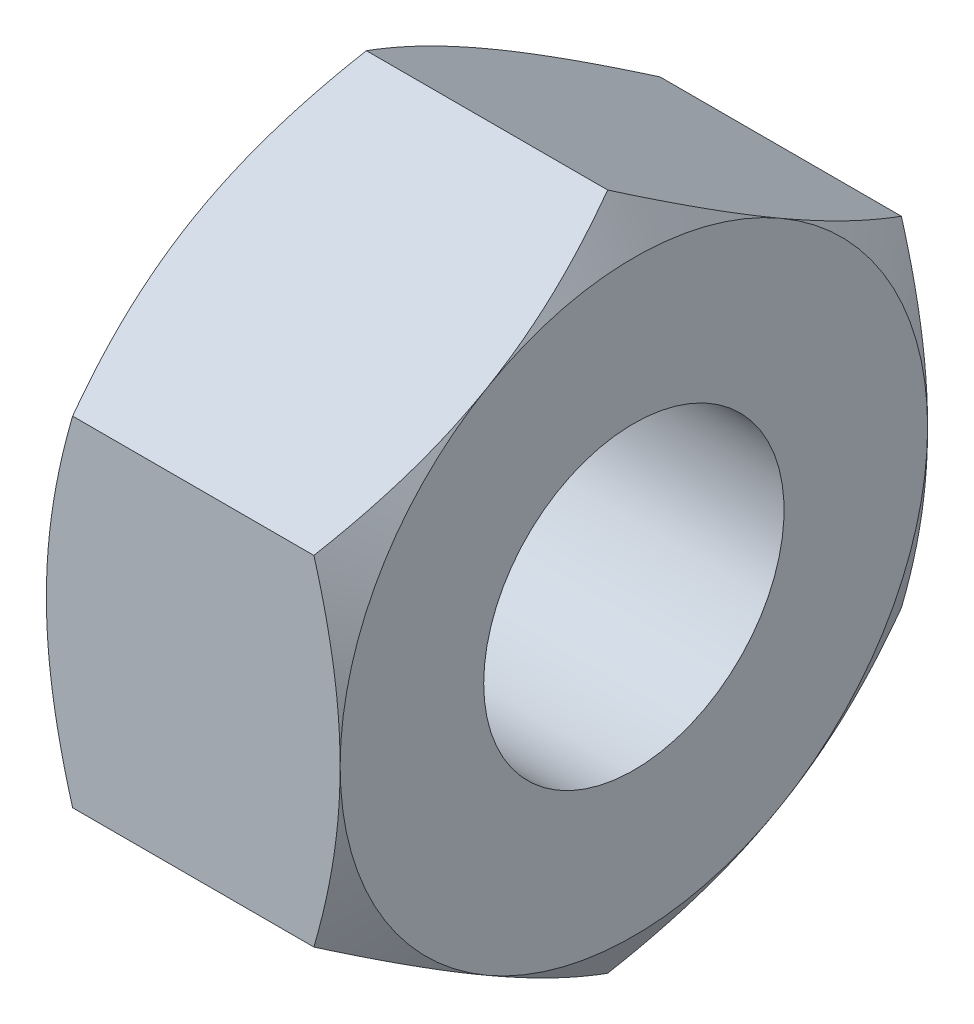
from build123d import *

# Parameters (mm, degrees)
BOSS_EXTRUDE1_DEPTH = 6.5
TAP1_D              = 6.647


with BuildPart() as part:
    # Sketch1 → Boss-Extrude1 (new body)
    with BuildSketch(Plane(origin=(0, 0, 0), x_dir=(0, 0, -1), z_dir=(1, 0, 0))):
        Polygon((6.5, -3.75277675), (6.5, 3.75277675), (0, 7.505553499), (-6.5, 3.75277675), (-6.5, -3.75277675), (0, -7.505553499), align=None)
    extrude(amount=BOSS_EXTRUDE1_DEPTH)

    # Sketch2 → Cut-Revolve1 (revolve, cut)
    with BuildSketch(Plane.XY):
        Polygon((6.5, 7.505553499), (6.5, 6.5), (5.919443416, 7.505553499), align=None)
        Polygon((0, 7.505553499), (0.580556584, 7.505553499), (0, 6.5), align=None)
    revolve(axis=Axis((-0.325, 0, 0), (1, 0, 0)), mode=Mode.SUBTRACT)

    # Tap1 (through all)
    with Locations(Plane(origin=(0, 0, 0), x_dir=(0, 0, -1), z_dir=(-1, 0, 0))):
        with Locations((0, 0)):
            Hole(TAP1_D / 2)


solid = part.part
